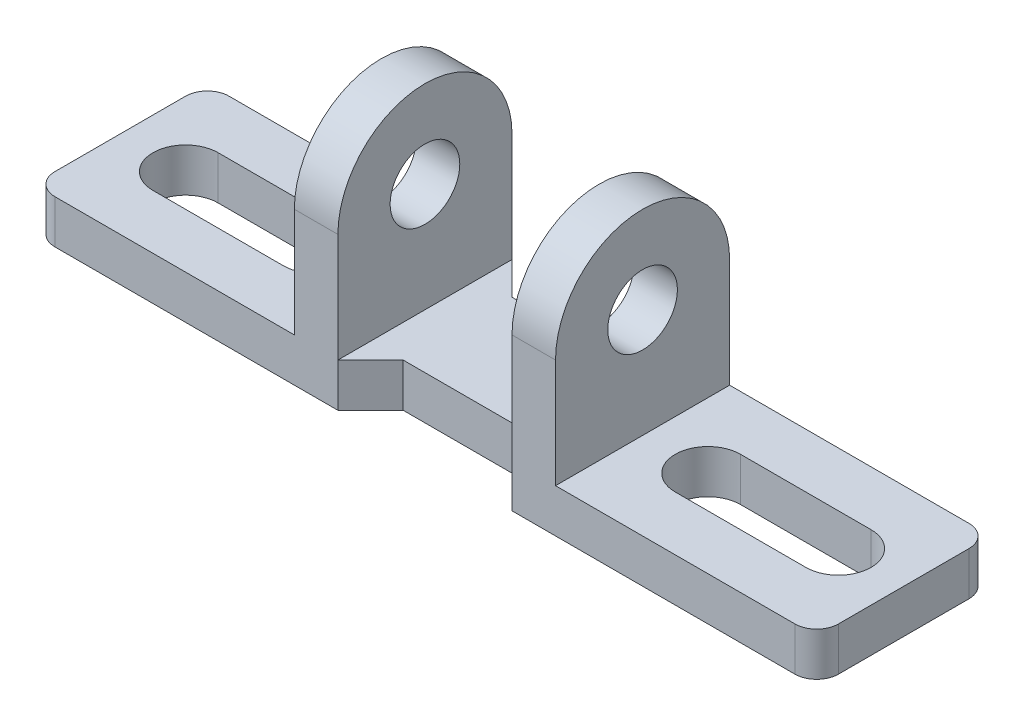
from build123d import *

# Parameters (mm, degrees)
SKETCH_1_W          = 36
SKETCH_1_H          = 8
EXTRUDE_1_DEPTH     = 2
SKETCH_2_W          = 2
SKETCH_2_H          = 8
EXTRUDE_2_DEPTH     = 9
CUT_EXTRUDE_1_DEPTH = 21.518284529
SKETCH_4_R          = 1.6
CUT_EXTRUDE_2_DEPTH = 27.702059846
FILLET_1_R          = 1


with BuildPart() as part:
    # 草图1 → 凸台-拉伸1 (new body)
    with BuildSketch(Plane(origin=(0, 0, 0), x_dir=(1, 0, 0), z_dir=(0, 1, 0))):
        Rectangle(SKETCH_1_W, SKETCH_1_H)
        with BuildLine():
            Line((-15, 1.5), (-9, 1.5))
            ThreePointArc((-9, 1.5), (-7.5, 0), (-9, -1.5))
            Line((-9, -1.5), (-15, -1.5))
            ThreePointArc((-15, -1.5), (-16.5, 0), (-15, 1.5))
        make_face(mode=Mode.SUBTRACT)
        with BuildLine():
            Line((9, 1.5), (15, 1.5))
            ThreePointArc((15, 1.5), (16.5, 0), (15, -1.5))
            Line((15, -1.5), (9, -1.5))
            ThreePointArc((9, -1.5), (7.5, 0), (9, 1.5))
        make_face(mode=Mode.SUBTRACT)
    extrude(amount=EXTRUDE_1_DEPTH)

    # 草图2 → 凸台-拉伸2 (add)
    with BuildSketch(Plane(origin=(0, 2, 0), x_dir=(1, 0, 0), z_dir=(0, 1, 0))):
        with Locations((-5, 0)):
            Rectangle(SKETCH_2_W, SKETCH_2_H)
        with Locations((5, 0)):
            Rectangle(SKETCH_2_W, SKETCH_2_H)
    extrude(amount=EXTRUDE_2_DEPTH)

    # 草图3 → 切除-拉伸1 (cut, through all)
    with BuildSketch(Plane(origin=(0, 2, 0), x_dir=(1, 0, 0), z_dir=(0, 1, 0))):
        Polygon((2.5, -2.5), (4, -4), (-4, -4), (-2.5, -2.5), align=None)
        Polygon((-2.5, 2.5), (2.5, 2.5), (4, 4), (-4, 4), align=None)
    extrude(amount=-CUT_EXTRUDE_1_DEPTH, mode=Mode.SUBTRACT)

    # 草图4 → 切除-拉伸2 (cut, through all)
    with BuildSketch(Plane(origin=(6, 0, 0), x_dir=(0, 0, -1), z_dir=(1, 0, 0))):
        with Locations((0, 7)):
            Circle(SKETCH_4_R)
        with BuildLine():
            Line((-4, 11), (-4, 6.999999618))
            ThreePointArc((-4, 6.999999618), (-2.82842726, 9.82842699), (0, 11))
            Line((0, 11), (-4, 11))
        make_face()
        with BuildLine():
            ThreePointArc((0, 11), (2.828427125, 9.828427125), (4, 7))
            Line((4, 7), (4, 11))
            Line((4, 11), (0, 11))
        make_face()
    extrude(amount=-CUT_EXTRUDE_2_DEPTH, mode=Mode.SUBTRACT)

    # 圆角1
    fillet_1_edges = [part.edges().sort_by_distance(p)[0] for p in [
        (18, 1, 4),
        (-18, 1, 4),
        (-18, 1, -4),
        (18, 1, -4),
    ]]
    fillet(fillet_1_edges, radius=FILLET_1_R)


solid = part.part
